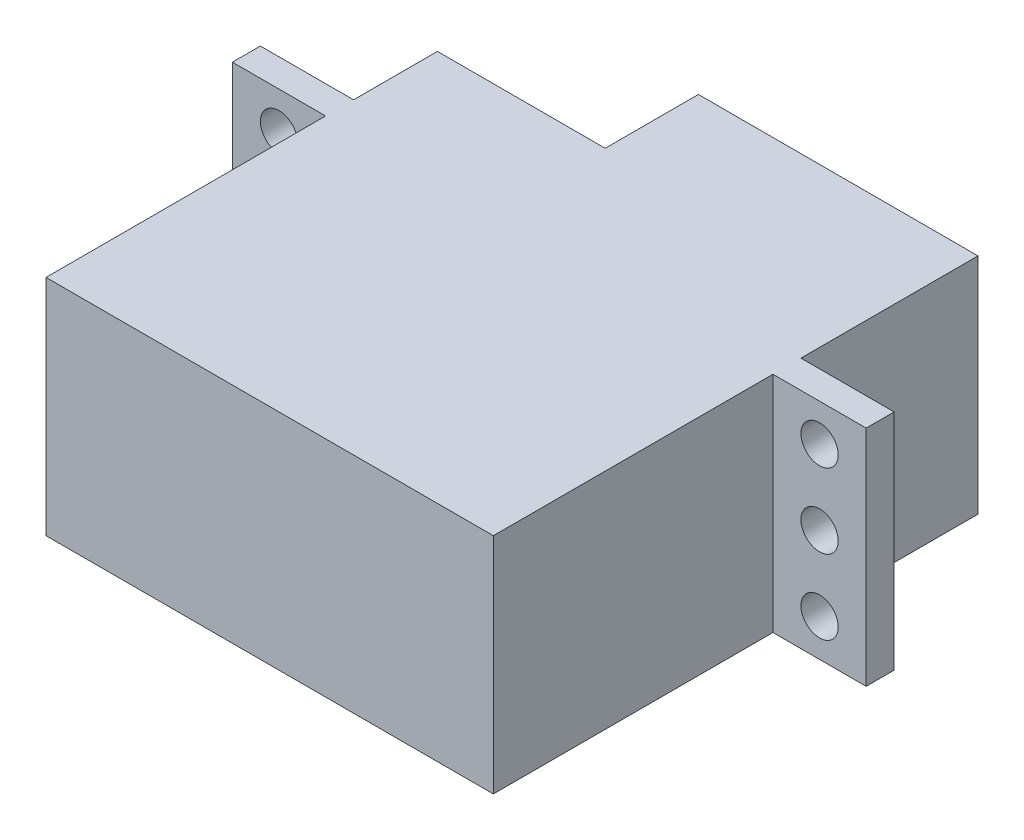
from build123d import *

# Parameters (mm, degrees)
SKETCH1_W           = 24
SKETCH1_H           = 12
BOSS_EXTRUDE1_DEPTH = 21
SKETCH2_W           = 34
SKETCH2_H           = 12
SKETCH2_R           = 1
BOSS_EXTRUDE2_DEPTH = 1.5
SKETCH3_W           = 15
SKETCH3_H           = 12
BOSS_EXTRUDE3_DEPTH = 5
SKETCH4_R           = 2
BOSS_EXTRUDE4_DEPTH = 4


with BuildPart() as part:
    # Sketch1 → Boss-Extrude1 (new body)
    with BuildSketch(Plane.XY):
        with Locations((12, -6)):
            Rectangle(SKETCH1_W, SKETCH1_H)
    extrude(amount=BOSS_EXTRUDE1_DEPTH)

    # Sketch2 → Boss-Extrude2 (add)
    with BuildSketch(Plane.XY.offset(6)):
        with Locations((12, -6)):
            Rectangle(SKETCH2_W, SKETCH2_H)
        with Locations((-2.5, -2)):
            Circle(SKETCH2_R, mode=Mode.SUBTRACT)
        with Locations((26.5, -2)):
            Circle(SKETCH2_R, mode=Mode.SUBTRACT)
        with Locations((26.5, -6)):
            Circle(SKETCH2_R, mode=Mode.SUBTRACT)
        with Locations((26.5, -10)):
            Circle(SKETCH2_R, mode=Mode.SUBTRACT)
        with Locations((-2.5, -6)):
            Circle(SKETCH2_R, mode=Mode.SUBTRACT)
        with Locations((-2.5, -10)):
            Circle(SKETCH2_R, mode=Mode.SUBTRACT)
    extrude(amount=-BOSS_EXTRUDE2_DEPTH)

    # Sketch3 → Boss-Extrude3 (add)
    with BuildSketch(Plane(origin=(0, 0, 0), x_dir=(-1, 0, 0), z_dir=(0, 0, -1))):
        with Locations((-16.5, -6)):
            Rectangle(SKETCH3_W, SKETCH3_H)
    extrude(amount=BOSS_EXTRUDE3_DEPTH)

    # Sketch4 → Boss-Extrude4 (add)
    with BuildSketch(Plane(origin=(0, 0, -5), x_dir=(-1, 0, 0), z_dir=(0, 0, -1))):
        with Locations((-17, -6)):
            Circle(SKETCH4_R)
    extrude(amount=BOSS_EXTRUDE4_DEPTH)


solid = part.part
